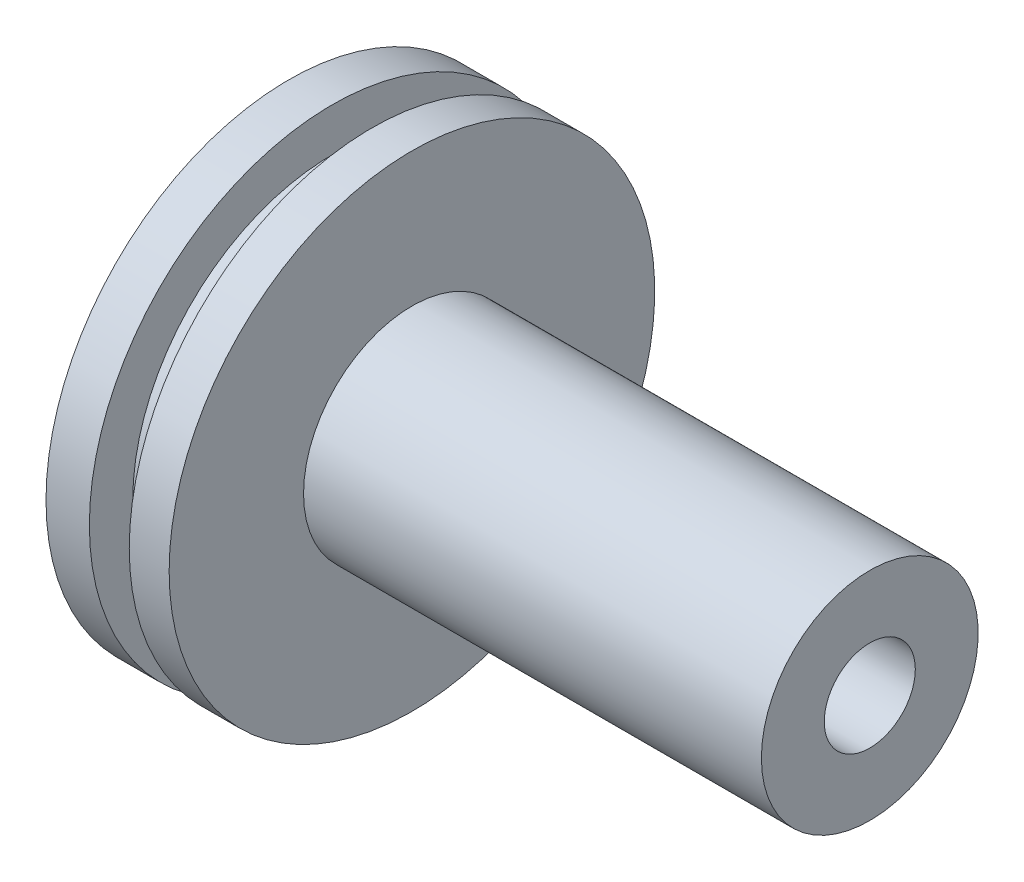
from build123d import *

# Parameters (mm, degrees)
M12X1_51_D     = 10.5
M12X1_51_DEPTH = 45
M12X1_51_TIP   = 3.15451825


with BuildPart() as part:
    # Эскиз1 → Повернуть1 (revolve)
    with BuildSketch(Plane.XY, mode=Mode.PRIVATE) as revolve_1_sk:
        Polygon((0, 0), (-70, 0), (-70, -9), (-67, -12.451105222), (-67, -28), (-62, -28), (-62, -23), (-57.4, -23), (-57.4, -28), (-52.8, -28), (-52.8, -12.5), (0, -12.5), align=None)
    revolve(revolve_1_sk.sketch.rotate(Axis((-541.044005746, 0, 0), (1, 0, 0)), 270), axis=Axis((-541.044005746, 0, 0), (1, 0, 0)))

    # Сверление под метчик M12x1.51
    with Locations(Plane(origin=(0, 0, 0), x_dir=(0, 0, 1), z_dir=(1, 0, 0))):
        with Locations((0, 0)):
            Hole(M12X1_51_D / 2, depth=M12X1_51_DEPTH)
            with Locations((0, 0, -(M12X1_51_DEPTH + M12X1_51_TIP / 2))):  # 118° drill point
                Cone(0, M12X1_51_D / 2, M12X1_51_TIP, mode=Mode.SUBTRACT)


solid = part.part
